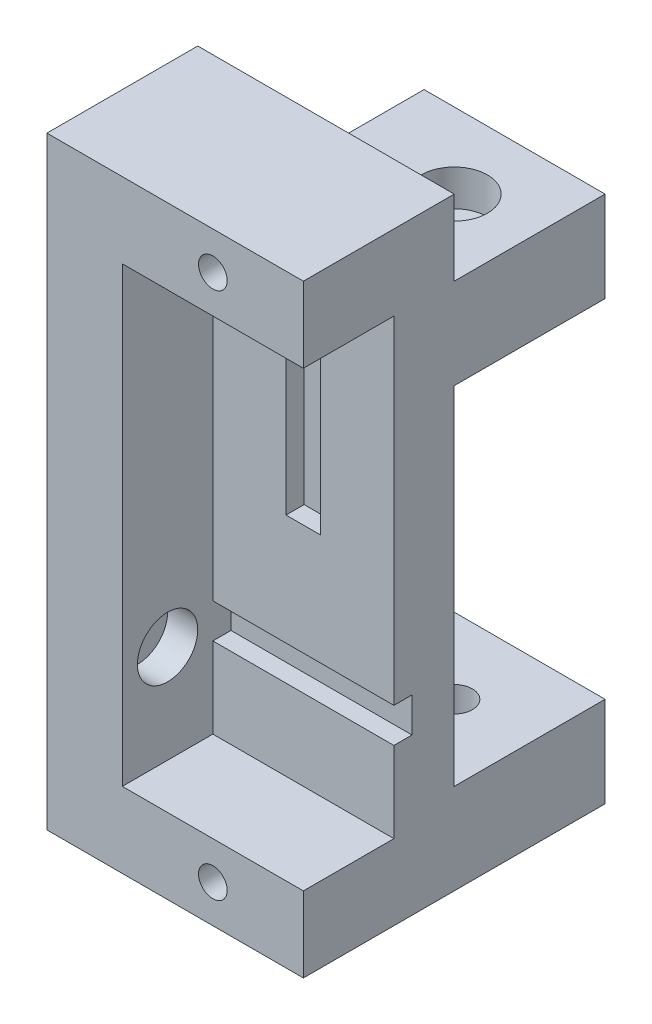
from build123d import *

# Parameters (mm, degrees)
ESQUISSE1_W                                       = 12
ESQUISSE1_H                                       = 40
BOSS_EXTRU_1_DEPTH                                = 4
ESQUISSE2_W                                       = 12
ESQUISSE2_H                                       = 6
BOSS_EXTRU_2_DEPTH                                = 10
ESQUISSE4_W                                       = 12
ESQUISSE4_H                                       = 5
BOSS_EXTRU_3_DEPTH                                = 6
ESQUISSE5_R                                       = 0.95
ENL_V_MAT_EXTRU_2_DEPTH                           = 5
ESQUISSE6_W                                       = 10
ESQUISSE6_H                                       = 40
BOSS_EXTRU_4_DEPTH                                = 5
ESQUISSE7_R                                       = 2
ENL_V_MAT_EXTRU_3_DEPTH                           = 2
CHAMBRAGE_POUR_VIS_SIX_PANS_CREUX_M21_D           = 2.4
CHAMBRAGE_POUR_VIS_SIX_PANS_CREUX_M21_DEPTH       = 6
CHAMBRAGE_POUR_VIS_SIX_PANS_CREUX_M21_CBORE_D     = 4.4
CHAMBRAGE_POUR_VIS_SIX_PANS_CREUX_M21_CBORE_DEPTH = 2.4
ESQUISSE15_W                                      = 12
ESQUISSE15_H                                      = 2.3
ESQUISSE15_W_2                                    = 2.3
ESQUISSE15_H_2                                    = 15
ENL_V_MAT_EXTRU_4_DEPTH                           = 1.2


with BuildPart() as part:
    # Esquisse1 → Boss.-Extru.1 (new body)
    with BuildSketch(Plane.XY):
        with Locations((4, 2.5)):
            Rectangle(ESQUISSE1_W, ESQUISSE1_H)
    extrude(amount=BOSS_EXTRU_1_DEPTH)

    # Esquisse2 → Boss.-Extru.2 (add)
    with BuildSketch(Plane(origin=(0, 0, 0), x_dir=(-1, 0, 0), z_dir=(0, 0, -1))):
        with Locations((-4, -14.5)):
            Rectangle(ESQUISSE2_W, ESQUISSE2_H)
    boss_extru_2 = extrude(amount=BOSS_EXTRU_2_DEPTH)

    # Symétrie1: Boss.-Extru.2 across plane
    add(boss_extru_2.mirror(Plane.ZX))

    # Esquisse4 → Boss.-Extru.3 (add)
    with BuildSketch(Plane.XY.offset(4)):
        with Locations((4, 20)):
            Rectangle(ESQUISSE4_W, ESQUISSE4_H)
        with Locations((4, -15)):
            Rectangle(ESQUISSE4_W, ESQUISSE4_H)
    extrude(amount=BOSS_EXTRU_3_DEPTH)

    # Esquisse5 → Enlèv. mat.-Extru.2 (cut)
    with BuildSketch(Plane.XY.offset(10)):
        with Locations((4, -15)):
            Circle(ESQUISSE5_R)
        with Locations(Location((4, 20, 0), (0, 0, 180))):
            Circle(ESQUISSE5_R)
    extrude(amount=-ENL_V_MAT_EXTRU_2_DEPTH, mode=Mode.SUBTRACT)

    # Esquisse6 → Boss.-Extru.4 (add)
    with BuildSketch(Plane.ZY.offset(2)):
        with Locations((5, 2.5)):
            Rectangle(ESQUISSE6_W, ESQUISSE6_H)
    extrude(amount=BOSS_EXTRU_4_DEPTH)

    # Esquisse7 → Enlèv. mat.-Extru.3 (cut)
    with BuildSketch(Plane(origin=(-2, 0, 0), x_dir=(0, 0, -1), z_dir=(1, 0, 0))):
        with Locations(Location((-7, -6, 0), (0, 0, 90))):
            Circle(ESQUISSE7_R)
    extrude(amount=-ENL_V_MAT_EXTRU_3_DEPTH, mode=Mode.SUBTRACT)

    # Chambrage pour vis à six pans creux M21
    with Locations(Plane(origin=(0, -17.5, 0), x_dir=(-1, 0, 0), z_dir=(0, -1, 0))):
        with Locations((-5, 5)):
            chambrage_pour_vis_six_pans_creux_m21 = CounterBoreHole(CHAMBRAGE_POUR_VIS_SIX_PANS_CREUX_M21_D / 2, CHAMBRAGE_POUR_VIS_SIX_PANS_CREUX_M21_CBORE_D / 2, CHAMBRAGE_POUR_VIS_SIX_PANS_CREUX_M21_CBORE_DEPTH, depth=CHAMBRAGE_POUR_VIS_SIX_PANS_CREUX_M21_DEPTH)

    # Symétrie2: Chambrage pour vis à six pans creux M21 across plane
    add(chambrage_pour_vis_six_pans_creux_m21.mirror(Plane.ZX), mode=Mode.SUBTRACT)

    # Esquisse15 → Enlèv. mat.-Extru.4 (cut)
    with BuildSketch(Plane.XY.offset(4)):
        with Locations((4, -6)):
            Rectangle(ESQUISSE15_W, ESQUISSE15_H)
        with Locations((4, 10)):
            Rectangle(ESQUISSE15_W_2, ESQUISSE15_H_2)
    extrude(amount=-ENL_V_MAT_EXTRU_4_DEPTH, mode=Mode.SUBTRACT)


solid = part.part
